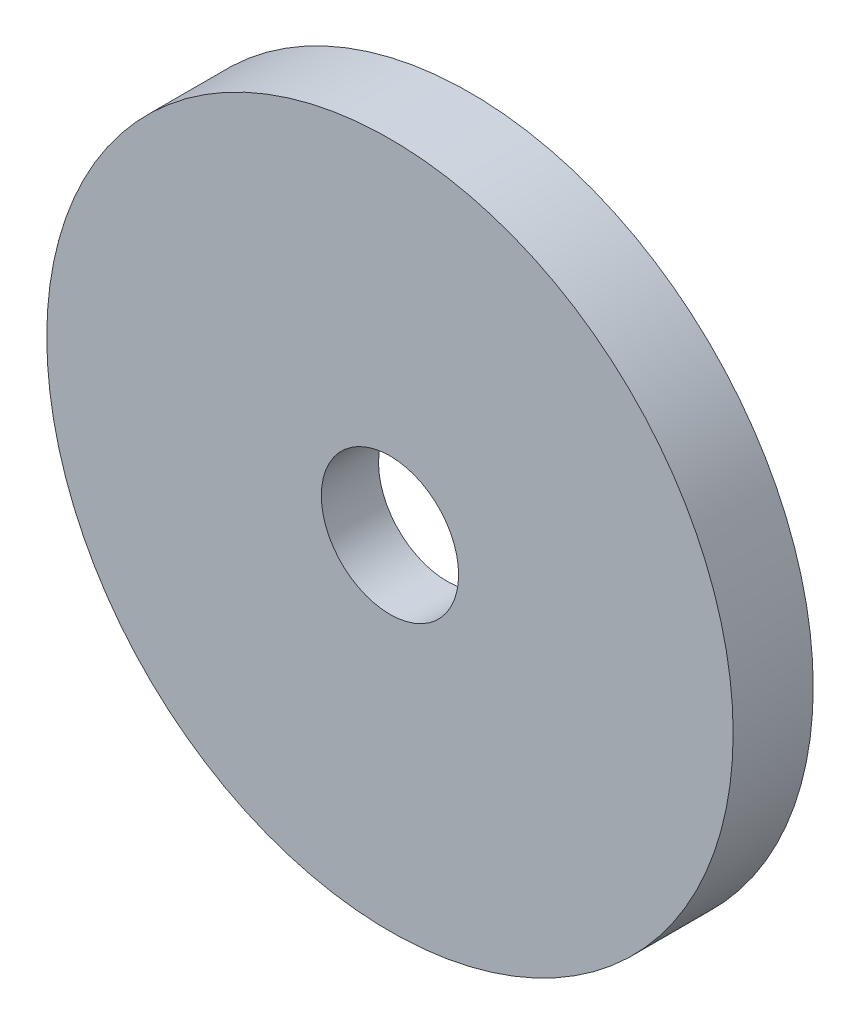
from build123d import *

# Parameters (mm, degrees)
SKETCH2_R           = 30
BOSS_EXTRUDE1_DEPTH = 6
SKETCH3_R           = 8
CUT_EXTRUDE1_DEPTH  = 2
SKETCH4_R           = 6
CUT_EXTRUDE2_DEPTH  = 5
SKETCH5_R           = 30
SKETCH5_R_2         = 8
CUT_EXTRUDE3_DEPTH  = 2
BOSS_EXTRUDE3_START = 3
SKETCH7_R           = 30
SKETCH7_R_2         = 20
BOSS_EXTRUDE3_DEPTH = 3
BOSS_EXTRUDE4_START = 1
SKETCH8_R           = 20
SKETCH8_R_2         = 6
BOSS_EXTRUDE4_DEPTH = 1


with BuildPart() as part:
    # Sketch2 → Boss-Extrude1 (new body)
    with BuildSketch(Plane.XY):
        Circle(SKETCH2_R)
    extrude(amount=BOSS_EXTRUDE1_DEPTH)

    # Sketch3 → Cut-Extrude1 (cut)
    with BuildSketch(Plane(origin=(0, 0, 0), x_dir=(-1, 0, 0), z_dir=(0, 0, -1))):
        Circle(SKETCH3_R)
    extrude(amount=-CUT_EXTRUDE1_DEPTH, mode=Mode.SUBTRACT)

    # Sketch4 → Cut-Extrude2 (cut)
    with BuildSketch(Plane(origin=(0, 0, 2), x_dir=(-1, 0, 0), z_dir=(0, 0, -1))):
        Circle(SKETCH4_R)
    extrude(amount=-CUT_EXTRUDE2_DEPTH, mode=Mode.SUBTRACT)

    # Sketch5 → Cut-Extrude3 (cut)
    with BuildSketch(Plane(origin=(0, 0, 0), x_dir=(-1, 0, 0), z_dir=(0, 0, -1))):
        Circle(SKETCH5_R)
        Circle(SKETCH5_R_2, mode=Mode.SUBTRACT)
    extrude(amount=-CUT_EXTRUDE3_DEPTH, mode=Mode.SUBTRACT)

    # Sketch7 → Boss-Extrude3 (add)
    with BuildSketch(Plane(origin=(0, 0, 2), x_dir=(-1, 0, 0), z_dir=(0, 0, -1)).offset(BOSS_EXTRUDE3_START)):
        Circle(SKETCH7_R)
        Circle(SKETCH7_R_2, mode=Mode.SUBTRACT)
    extrude(amount=-BOSS_EXTRUDE3_DEPTH)

    # Sketch8 → Boss-Extrude4 (add)
    with BuildSketch(Plane(origin=(0, 0, 2), x_dir=(-1, 0, 0), z_dir=(0, 0, -1)).offset(BOSS_EXTRUDE4_START)):
        Circle(SKETCH8_R)
        Circle(SKETCH8_R_2, mode=Mode.SUBTRACT)
    extrude(amount=-BOSS_EXTRUDE4_DEPTH)


solid = part.part
